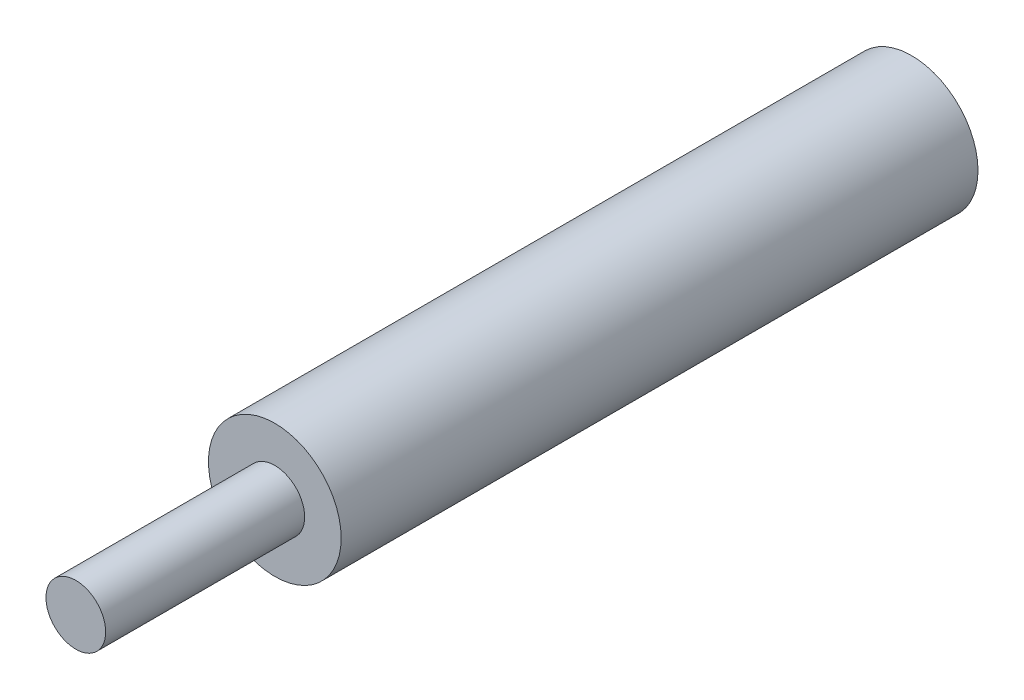
from build123d import *

# Parameters (mm, degrees)
SKETCH1_R           = 16.675
BOSS_EXTRUDE1_DEPTH = 80
SKETCH2_R           = 7.5
BOSS_EXTRUDE2_DEPTH = 50


with BuildPart() as part:
    # Sketch1 → Boss-Extrude1 (new, symmetric)
    with BuildSketch(Plane.XY):
        Circle(SKETCH1_R)
    extrude(amount=BOSS_EXTRUDE1_DEPTH, both=True)

    # Sketch2 → Boss-Extrude2 (add)
    with BuildSketch(Plane.XY.offset(80)):
        Circle(SKETCH2_R)
    extrude(amount=BOSS_EXTRUDE2_DEPTH)


solid = part.part
